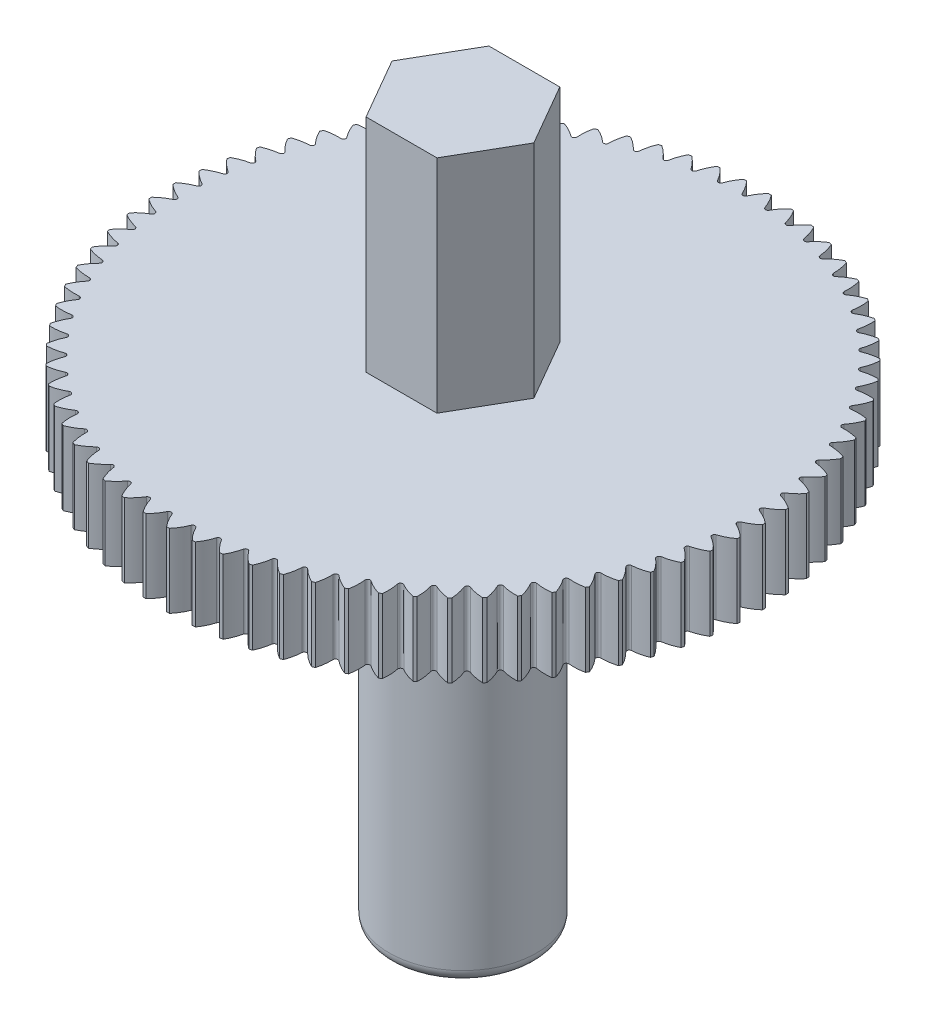
from build123d import *

# Parameters (mm, degrees)
CUT_EXTRUDE1_DEPTH = 10
CIRPATTERN1_COUNT  = 75
CUT_EXTRUDE2_START = -9
SKETCH3_R          = 3
CUT_EXTRUDE2_DEPTH = 9
FILLET1_R          = 0.5


with BuildPart() as part:
    # Sketch1 → Revolve1 (revolve)
    with BuildSketch(Plane.XY, mode=Mode.PRIVATE) as revolve1_sk:
        Polygon((0, 0), (0, 29), (3, 29), (3, 20), (12, 20), (12, 17), (3, 17), (3, 0), align=None)
    revolve(revolve1_sk.sketch.rotate(Axis((0, 0, 0), (0, 1, 0)), 90), axis=Axis((0, 0, 0), (0, 1, 0)))

    # Sketch2 → Cut-Extrude1 (cut)
    with BuildSketch(Plane(origin=(0, 20, 0), x_dir=(1, 0, 0), z_dir=(0, 1, 0))):
        with BuildLine():
            Line((-0.45, 12), (0.45, 12))
            ThreePointArc((0.45, 12), (0.248504486, 11.744148972), (0.091203345, 11.458988418))
            ThreePointArc((0.091203345, 11.458988418), (0, 11.4), (-0.091203345, 11.458988418))
            ThreePointArc((-0.091203345, 11.458988418), (-0.248504486, 11.744148972), (-0.45, 12))
        make_face()
    cut_extrude1 = extrude(amount=-CUT_EXTRUDE1_DEPTH, mode=Mode.SUBTRACT)

    # CirPattern1: Cut-Extrude1 ×75 about axis
    cirpattern1_axis = Axis((0, 0, 0), (0, 1, 0))
    for i in range(1, CIRPATTERN1_COUNT):
        add(cut_extrude1.rotate(cirpattern1_axis, i * 360 / CIRPATTERN1_COUNT), mode=Mode.SUBTRACT)

    # Sketch3 → Cut-Extrude2 (cut)
    with BuildSketch(Plane(origin=(0, 29, 0), x_dir=(1, 0, 0), z_dir=(0, 1, 0)).offset(CUT_EXTRUDE2_START)):
        with Locations(Location((0, 0, 0), (0, 0, 90))):
            Circle(SKETCH3_R)
        Polygon((-1.443375673, 2.5), (-2.886751346, 0), (-1.443375673, -2.5), (1.443375673, -2.5), (2.886751346, 0), (1.443375673, 2.5), align=None, mode=Mode.SUBTRACT)
    extrude(amount=CUT_EXTRUDE2_DEPTH, mode=Mode.SUBTRACT)

    # Fillet1
    fillet1_edges = [part.edges().sort_by_distance(p)[0] for p in [
        (0, 0, 3),
    ]]
    fillet(fillet1_edges, radius=FILLET1_R)


solid = part.part
